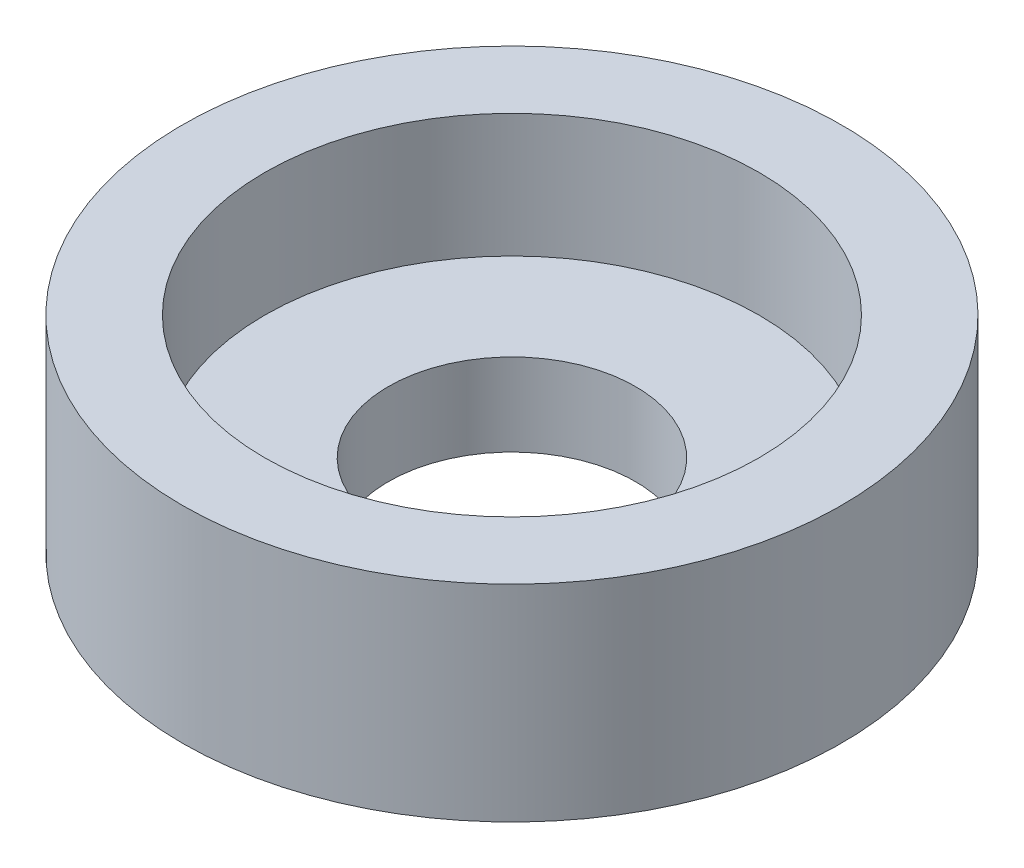
from build123d import *

# Parameters (mm, degrees)
SKETCH_1_R          = 8
EXTRUDE_1_DEPTH     = 5
SKETCH_2_R          = 6
CUT_EXTRUDE_1_DEPTH = 3
SKETCH_3_R          = 3
CUT_EXTRUDE_2_DEPTH = 12.704699911


with BuildPart() as part:
    # 草图1 → 凸台-拉伸1 (new body)
    with BuildSketch(Plane(origin=(0, 0, 0), x_dir=(1, 0, 0), z_dir=(0, 1, 0))):
        with Locations(Location((0, 0, 0), (0, 0, 270))):
            Circle(SKETCH_1_R)
    extrude(amount=EXTRUDE_1_DEPTH)

    # 草图2 → 切除-拉伸1 (cut)
    with BuildSketch(Plane(origin=(0, 5, 0), x_dir=(1, 0, 0), z_dir=(0, 1, 0))):
        with Locations(Location((0, 0, 0), (0, 0, 270))):
            Circle(SKETCH_2_R)
    extrude(amount=-CUT_EXTRUDE_1_DEPTH, mode=Mode.SUBTRACT)

    # 草图3 → 切除-拉伸2 (cut, through all)
    with BuildSketch(Plane(origin=(0, 2, 0), x_dir=(1, 0, 0), z_dir=(0, 1, 0))):
        with Locations(Location((0, 0, 0), (0, 0, 270))):
            Circle(SKETCH_3_R)
    extrude(amount=-CUT_EXTRUDE_2_DEPTH, mode=Mode.SUBTRACT)


solid = part.part
